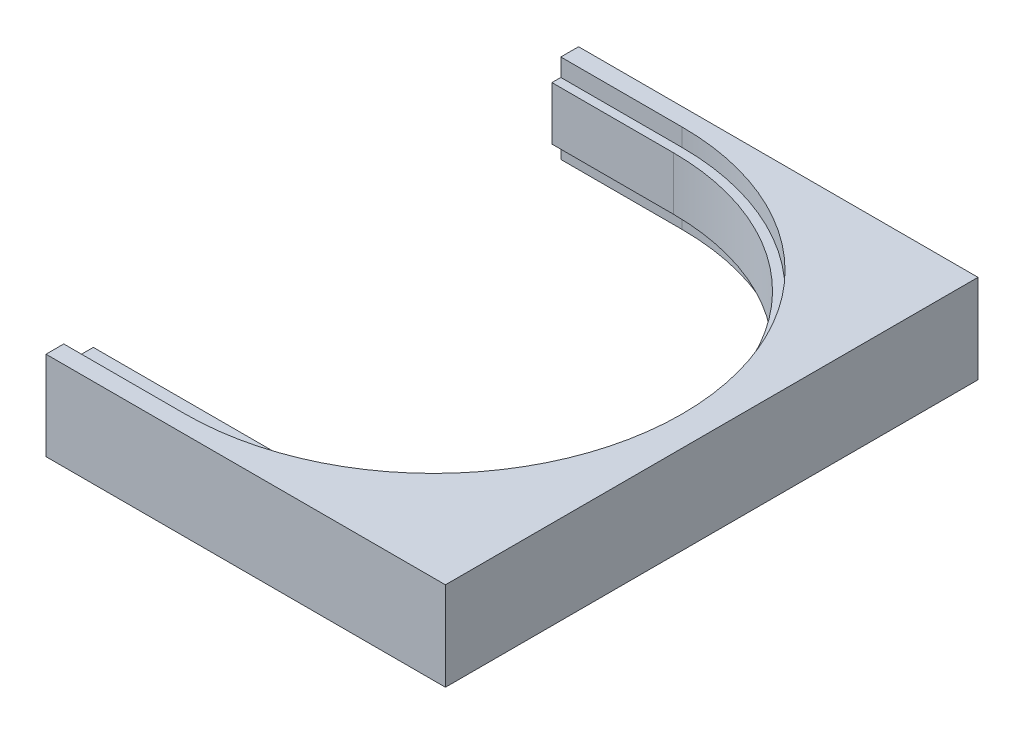
from build123d import *

# Parameters (mm, degrees)
BOSS_EXTRUDE1_DEPTH = 3.81
BOSS_EXTRUDE2_DEPTH = 2.286


with BuildPart() as part:
    # Sketch1 → Boss-Extrude1 (new, symmetric)
    with BuildSketch(Plane(origin=(0, 0, 0), x_dir=(1, 0, 0), z_dir=(0, 1, 0))):
        with BuildLine():
            Line((0, 45.72), (0, 44.196))
            Line((0, 44.196), (10.414, 44.196))
            ThreePointArc((10.414, 44.196), (31.75, 22.86), (10.414, 1.524))
            Line((10.414, 1.524), (0, 1.524))
            Line((0, 1.524), (0, 0))
            Line((0, 0), (34.29, 0))
            Line((34.29, 0), (34.29, 45.72))
            Line((34.29, 45.72), (0, 45.72))
        make_face()
    extrude(amount=BOSS_EXTRUDE1_DEPTH, both=True)

    # Sketch2 → Boss-Extrude2 (add, symmetric)
    with BuildSketch(Plane(origin=(0, 0, 0), x_dir=(1, 0, 0), z_dir=(0, 1, 0))):
        with BuildLine():
            Line((0, 4.064), (18.780591899, 4.064))
            ThreePointArc((18.780591899, 4.064), (30.538591673, 27.136714393), (10.414, 43.434))
            Line((10.414, 43.434), (0, 43.434))
            Line((0, 43.434), (0, 44.196))
            Line((0, 44.196), (10.414, 44.196))
            ThreePointArc((10.414, 44.196), (31.75, 22.86), (10.414, 1.524))
            Line((10.414, 1.524), (0, 1.524))
            Line((0, 1.524), (0, 4.064))
        make_face()
    extrude(amount=BOSS_EXTRUDE2_DEPTH, both=True)


solid = part.part
